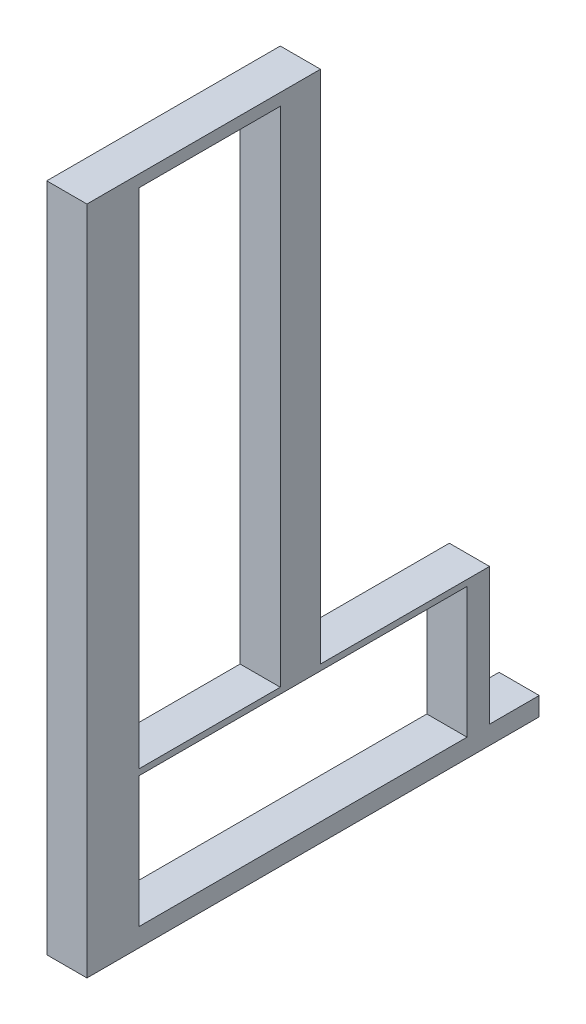
from build123d import *

# Parameters (mm, degrees)
SKETCH4_W                              = 44.704
SKETCH4_H                              = 159.004
SKETCH4_W_2                            = 103.7209
SKETCH4_H_2                            = 41.275
BOSS_EXTRUDE1_DEPTH                    = 12.7
F_18_0_1695_DIAMETER_HOLE1_D           = 4.3053
F_18_0_1695_DIAMETER_HOLE1_DEPTH       = 4.572
F_18_0_1695_DIAMETER_HOLE1_CSINK_D     = 5.5753
F_18_0_1695_DIAMETER_HOLE1_CSINK_ANGLE = 90
F_18_0_1695_DIAMETER_HOLE1_TIP         = 1.293442612
SKETCH11_W                             = 12.158133317
SKETCH11_H                             = 41.275
CUT_EXTRUDE3_DEPTH                     = 1.27
CUT_EXTRUDE1_DEPTH                     = 5.08
CUT_EXTRUDE2_DEPTH                     = 5.08
CHAMFER1_SIZE                          = 0.635


with BuildPart() as part:
    # Sketch4 → Boss-Extrude1 (new body)
    with BuildSketch(Plane(origin=(0, 0, 0), x_dir=(0, 0, -1), z_dir=(1, 0, 0))):
        Polygon((55.8038, 91.35), (-17.991666651, 91.35), (-17.991666651, -120.4686), (124.941666683, -120.4686), (124.941666683, -114.6186), (109.2327, -114.6186), (109.2327, -71.4386), (55.8038, -71.4386), align=None)
        with Locations((20.7518, 8.0634)):
            Rectangle(SKETCH4_W, SKETCH4_H, mode=Mode.SUBTRACT)
        with Locations((50.26025, -93.9811)):
            Rectangle(SKETCH4_W_2, SKETCH4_H_2, mode=Mode.SUBTRACT)
    extrude(amount=BOSS_EXTRUDE1_DEPTH)

    # #18 (0.1695) Diameter Hole1
    with Locations(Plane(origin=(0, 0, -109.2327), x_dir=(-1, 0, 0), z_dir=(0, 0, -1))):
        with Locations((-5.08, -95.6956), (-5.08, -75.3756)):
            CounterSinkHole(F_18_0_1695_DIAMETER_HOLE1_D / 2, F_18_0_1695_DIAMETER_HOLE1_CSINK_D / 2, depth=F_18_0_1695_DIAMETER_HOLE1_DEPTH, counter_sink_angle=F_18_0_1695_DIAMETER_HOLE1_CSINK_ANGLE)
            with Locations((0, 0, -(F_18_0_1695_DIAMETER_HOLE1_DEPTH + F_18_0_1695_DIAMETER_HOLE1_TIP / 2))):  # 118° drill point
                Cone(0, F_18_0_1695_DIAMETER_HOLE1_D / 2, F_18_0_1695_DIAMETER_HOLE1_TIP, mode=Mode.SUBTRACT)

    # Sketch11 → Cut-Extrude3 (cut)
    with BuildSketch(Plane.ZY):
        with Locations((7.679266659, -93.9811)):
            Rectangle(SKETCH11_W, SKETCH11_H)
    extrude(amount=-CUT_EXTRUDE3_DEPTH, mode=Mode.SUBTRACT)

    # Sketch9 → Cut-Extrude1 (cut)
    with BuildSketch(Plane.XZ.offset(120.4686)):
        Polygon((3.175, 13.758333317), (6.35, 16.933333317), (9.525, 13.758333317), (6.35, 10.583333317), align=None)
        Polygon((3.175, -120.708333349), (6.35, -117.533333349), (9.525, -120.708333349), (6.35, -123.883333349), align=None)
    extrude(amount=-CUT_EXTRUDE1_DEPTH, mode=Mode.SUBTRACT)

    # Sketch10 → Cut-Extrude2 (cut)
    with BuildSketch(Plane.ZY):
        Polygon((13.758333317, 90.291666667), (16.933333317, 87.116666667), (13.758333317, 83.941666667), (10.583333317, 87.116666667), align=None)
        Polygon((13.758333317, -65.0886), (16.933333317, -68.2636), (13.758333317, -71.4386), (10.583333317, -68.2636), align=None)
    extrude(amount=-CUT_EXTRUDE2_DEPTH, mode=Mode.SUBTRACT)

    # Chamfer1
    chamfer1_edges = [part.edges().sort_by_distance(p)[0] for p in [
        (5.08, 88.704166667, 12.170833317),
        (5.08, 88.704166667, 15.345833317),
        (5.08, 85.529166667, 15.345833317),
        (5.08, 85.529166667, 12.170833317),
        (0, 88.704166667, 12.170833317),
        (0, 85.529166667, 12.170833317),
        (0, 85.529166667, 15.345833317),
        (0, 88.704166667, 15.345833317),
        (5.08, -66.6761, 12.170833317),
        (5.08, -66.6761, 15.345833317),
        (5.08, -69.8511, 15.345833317),
        (5.08, -69.8511, 12.170833317),
        (0, -66.6761, 12.170833317),
        (0, -69.8511, 12.170833317),
        (0, -69.8511, 15.345833317),
        (0, -66.6761, 15.345833317),
        (4.7625, -115.3886, 12.170833317),
        (4.7625, -115.3886, 15.345833317),
        (7.9375, -115.3886, 15.345833317),
        (7.9375, -115.3886, 12.170833317),
        (4.7625, -120.4686, 12.170833317),
        (7.9375, -120.4686, 12.170833317),
        (7.9375, -120.4686, 15.345833317),
        (4.7625, -120.4686, 15.345833317),
        (4.7625, -115.3886, -122.295833349),
        (4.7625, -115.3886, -119.120833349),
        (7.9375, -115.3886, -119.120833349),
        (7.9375, -115.3886, -122.295833349),
        (4.7625, -120.4686, -122.295833349),
        (7.9375, -120.4686, -122.295833349),
        (7.9375, -120.4686, -119.120833349),
        (4.7625, -120.4686, -119.120833349),
    ]]
    chamfer(chamfer1_edges, length=CHAMFER1_SIZE)


solid = part.part
